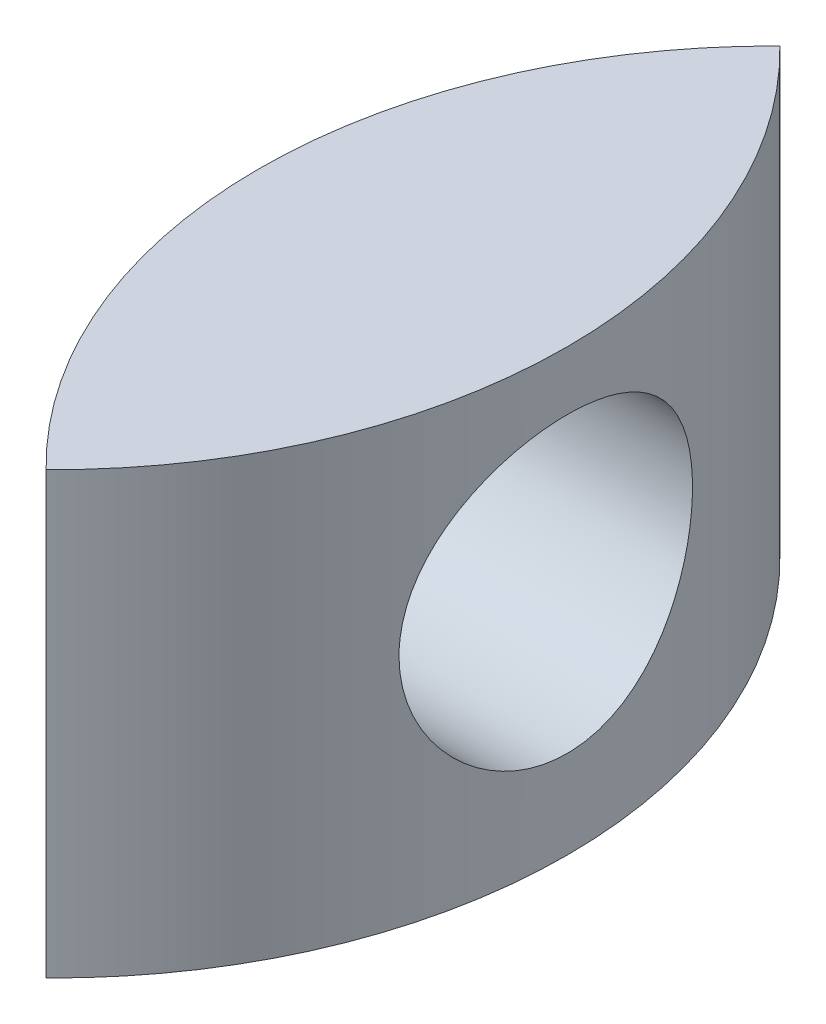
from build123d import *

# Parameters (mm, degrees)
BOSS_EXTRUDE1_DEPTH     = 76.2
CUT_EXTRUDE1_REACH      = 104.716
CUT_EXTRUDE1_END_RADIUS = 88.9
SKETCH2_R               = 25.4


with BuildPart() as part:
    # Sketch1 → Boss-Extrude1 (new body)
    with BuildSketch(Plane(origin=(0, 0, 0), x_dir=(1, 0, 0), z_dir=(0, 1, 0))):
        with BuildLine():
            Line((0, 63.5), (0, -63.5))
            ThreePointArc((0, -63.5), (26.682960533, 0), (0, 63.5))
        make_face()
    extrude(amount=BOSS_EXTRUDE1_DEPTH)

    # Cut-Extrude1: up to this cylinder (the profile starts inside it)
    cut_extrude1_end = Plane(origin=(-62.217039467, 40.64, 0), z_dir=(0, -1, 0)) * Cylinder(CUT_EXTRUDE1_END_RADIUS, 388.232, mode=Mode.PRIVATE)
    # Sketch2 → Cut-Extrude1 (cut, up to the surface)
    with BuildSketch(Plane.ZY, mode=Mode.PRIVATE) as cut_extrude1_sk1:
        with Locations((0, 40.64)):
            Circle(SKETCH2_R)
    cut_extrude1_tool1 = extrude(cut_extrude1_sk1.sketch, amount=-CUT_EXTRUDE1_REACH, mode=Mode.PRIVATE) & cut_extrude1_end
    add(cut_extrude1_tool1.solids().sort_by_distance((0, 40.64, 0))[0], mode=Mode.SUBTRACT)

    # Mirror1: part across plane


with BuildPart() as part_1:
    add(part.part)
    add(part.part.mirror(Plane(origin=(0, 76.2, -63.5), x_dir=(0, 0, 1), z_dir=(1, 0, 0))))


solid = part_1.part
